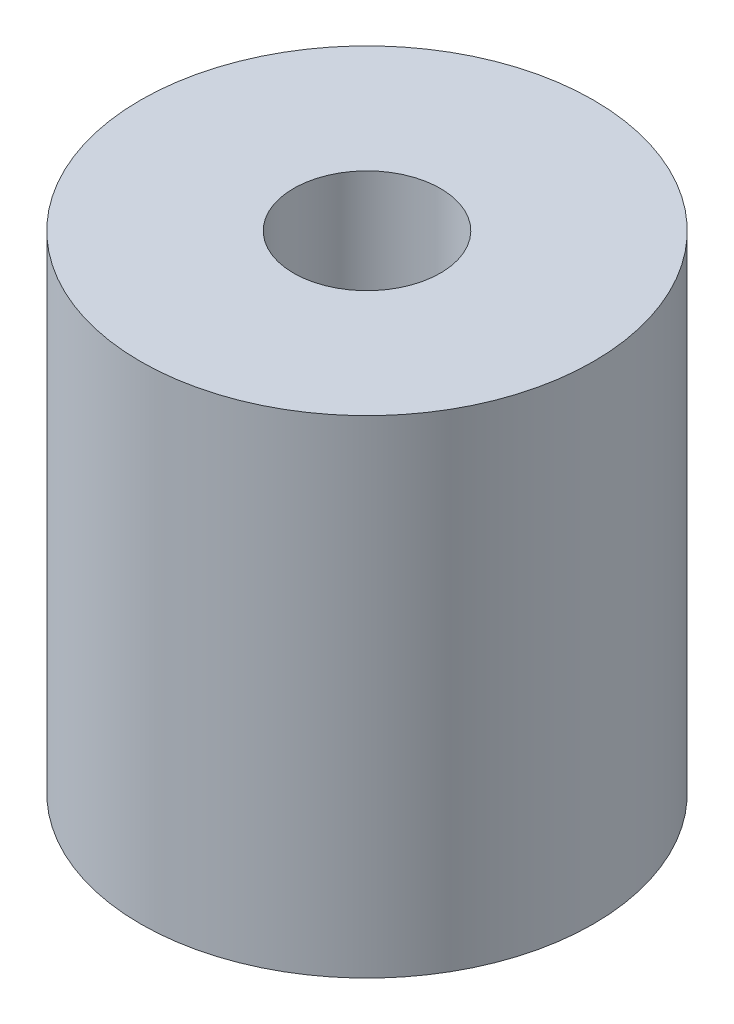
from build123d import *

# Parameters (mm, degrees)
SKETCH1_R           = 10.1854
SKETCH1_R_2         = 3.302
BOSS_EXTRUDE1_DEPTH = 21.9075


with BuildPart() as part:
    # Sketch1 → Boss-Extrude1 (new body)
    with BuildSketch(Plane(origin=(0, 0, 0), x_dir=(1, 0, 0), z_dir=(0, 1, 0))):
        with Locations(Location((0, 0, 0), (0, 0, 270))):
            Circle(SKETCH1_R)
        with Locations(Location((0, 0, 0), (0, 0, 270))):
            Circle(SKETCH1_R_2, mode=Mode.SUBTRACT)
    extrude(amount=-BOSS_EXTRUDE1_DEPTH)


solid = part.part
